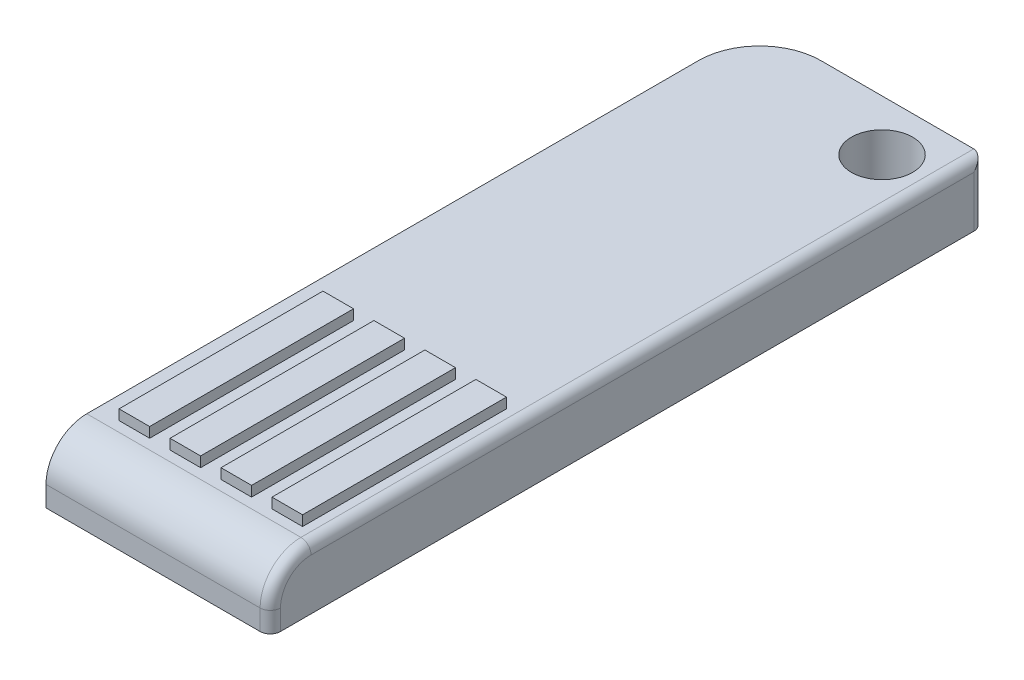
from build123d import *

# Parameters (mm, degrees)
SKETCH1_W           = 11
SKETCH1_H           = 35
BOSS_EXTRUDE1_DEPTH = 3
SKETCH2_R           = 1.5
CUT_EXTRUDE1_DEPTH  = 3
FILLET1_R           = 3
SKETCH3_W           = 1.5
SKETCH3_H           = 10
BOSS_EXTRUDE2_DEPTH = 0.5
FILLET4_R           = 2
FILLET5_R           = 0.5


with BuildPart() as part:
    # Sketch1 → Boss-Extrude1 (new body)
    with BuildSketch(Plane(origin=(0, 0, 0), x_dir=(1, 0, 0), z_dir=(0, 1, 0))):
        Rectangle(SKETCH1_W, SKETCH1_H)
    extrude(amount=BOSS_EXTRUDE1_DEPTH)

    # Sketch2 → Cut-Extrude1 (cut)
    with BuildSketch(Plane(origin=(0, 3, 0), x_dir=(1, 0, 0), z_dir=(0, 1, 0))):
        with Locations(Location((3, 15, 0), (0, 0, 270))):
            Circle(SKETCH2_R)
    extrude(amount=-CUT_EXTRUDE1_DEPTH, mode=Mode.SUBTRACT)

    # Fillet1
    fillet1_edges = [part.edges().sort_by_distance(p)[0] for p in [
        (-5.5, 1.5, -17.5),
    ]]
    fillet(fillet1_edges, radius=FILLET1_R)

    # Sketch3 → Boss-Extrude2 (add)
    with BuildSketch(Plane(origin=(0, 3, 0), x_dir=(1, 0, 0), z_dir=(0, 1, 0))):
        with Locations((-1.167481663, -10)):
            Rectangle(SKETCH3_W, SKETCH3_H)
        with Locations((-3.667481663, -10)):
            Rectangle(SKETCH3_W, SKETCH3_H)
        with Locations((1.332518337, -10)):
            Rectangle(SKETCH3_W, SKETCH3_H)
        with Locations((3.832518337, -10)):
            Rectangle(SKETCH3_W, SKETCH3_H)
    extrude(amount=BOSS_EXTRUDE2_DEPTH)

    # Fillet4
    fillet4_edges = [part.edges().sort_by_distance(p)[0] for p in [
        (0, 3, 17.5),
    ]]
    fillet(fillet4_edges, radius=FILLET4_R)

    # Fillet5
    fillet5_edges = [part.edges().sort_by_distance(p)[0] for p in [
        (5.5, 1.5, -17.5),
        (5.5, 3, -1),
        (5.5, 0.5, 17.5),
        (5.5, 2.414213562, 16.914213562),
    ]]
    fillet(fillet5_edges, radius=FILLET5_R)


solid = part.part
